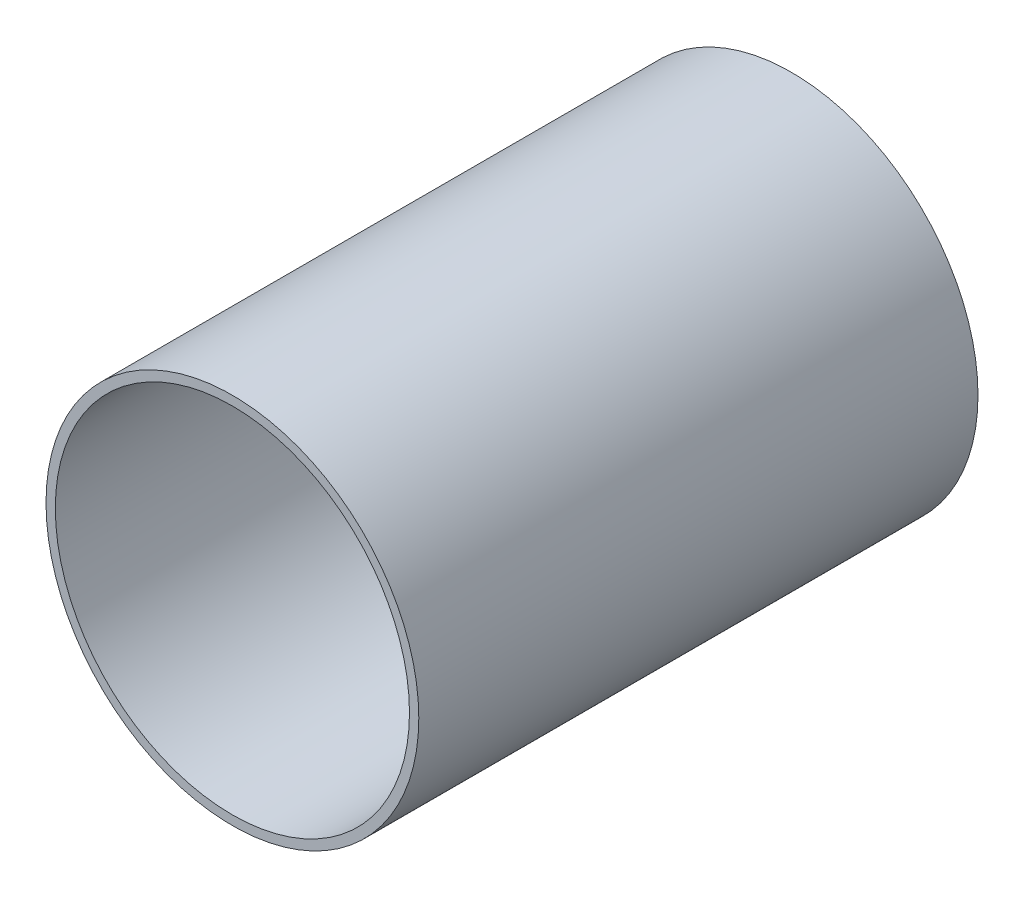
from build123d import *

# Parameters (mm, degrees)
SCHIZZO1_R                   = 100
SCHIZZO1_R_2                 = 95
ESTRUSIONE_ESTRUSIONE1_DEPTH = 300


with BuildPart() as part:
    # Schizzo1 → Estrusione-Estrusione1 (new body)
    with BuildSketch(Plane.XY):
        with Locations((0, 11.660834247)):
            Circle(SCHIZZO1_R)
        with Locations((0, 11.660834247)):
            Circle(SCHIZZO1_R_2, mode=Mode.SUBTRACT)
    extrude(amount=ESTRUSIONE_ESTRUSIONE1_DEPTH)


solid = part.part
